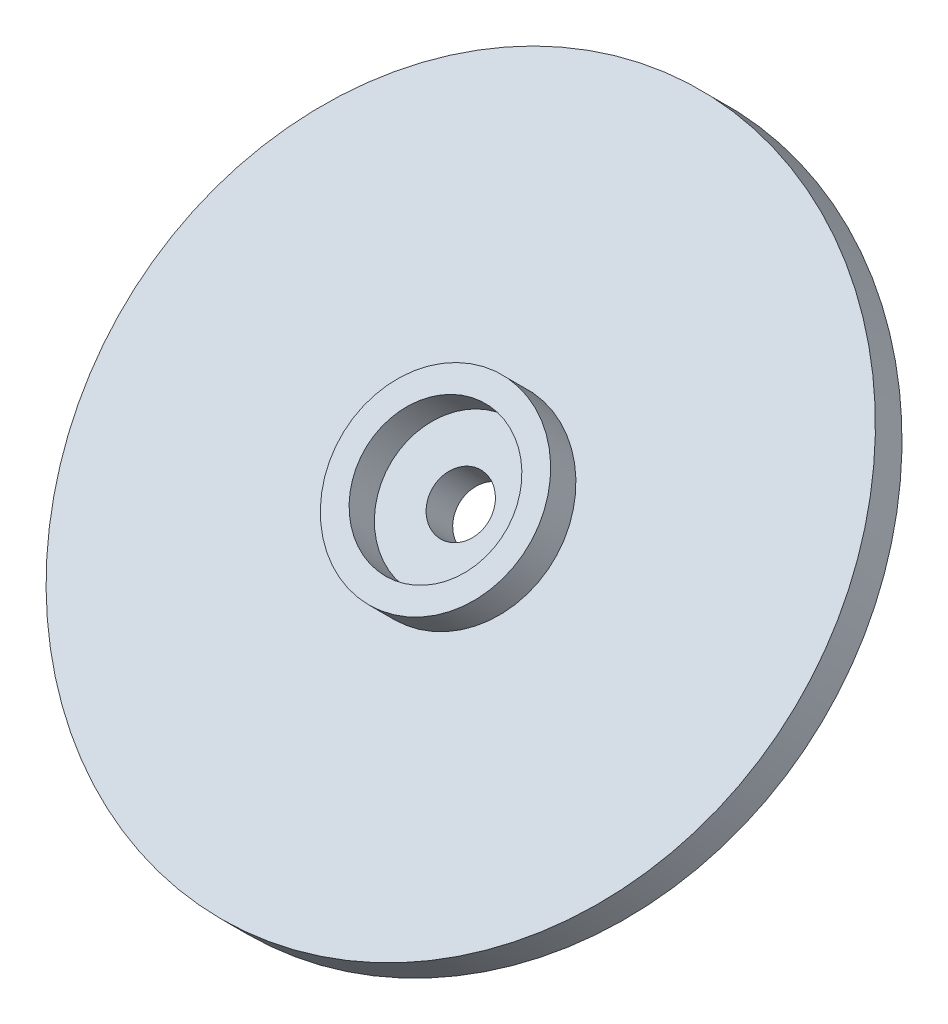
from build123d import *

# Parameters (mm, degrees)
SKIZZE2_R                       = 180
SKIZZE2_R_2                     = 15.05
AUFSATZ_LINEAR_AUSTRAGEN1_DEPTH = 20
SKIZZE5_R                       = 50
SKIZZE5_R_2                     = 37.5
AUFSATZ_LINEAR_AUSTRAGEN3_DEPTH = 19


with BuildPart() as part:
    # Skizze2 → Aufsatz-Linear austragen1 (new body)
    with BuildSketch(Plane(origin=(0, 9.32969619, 9.32969619), x_dir=(1, 0, 0), z_dir=(0, 0.7071067811865464, 0.7071067811865488))):
        with Locations(Location((0, 180, 0), (0, 0, 270))):
            Circle(SKIZZE2_R)
        with Locations(Location((0, 180, 0), (0, 0, 270))):
            Circle(SKIZZE2_R_2, mode=Mode.SUBTRACT)
    extrude(amount=AUFSATZ_LINEAR_AUSTRAGEN1_DEPTH)


with BuildPart() as body_2:
    # Skizze5 → Aufsatz-Linear austragen3 (new body)
    with BuildSketch(Plane(origin=(0, 23.471831814, 23.471831814), x_dir=(1, 0, 0), z_dir=(0, 0.7071067811865465, 0.7071067811865487))):
        with Locations(Location((0, 180, 0), (0, 0, 270))):
            Circle(SKIZZE5_R)
        with Locations(Location((0, 180, 0), (0, 0, 270))):
            Circle(SKIZZE5_R_2, mode=Mode.SUBTRACT)
    extrude(amount=AUFSATZ_LINEAR_AUSTRAGEN3_DEPTH)


solid = Compound([part.part, body_2.part])
